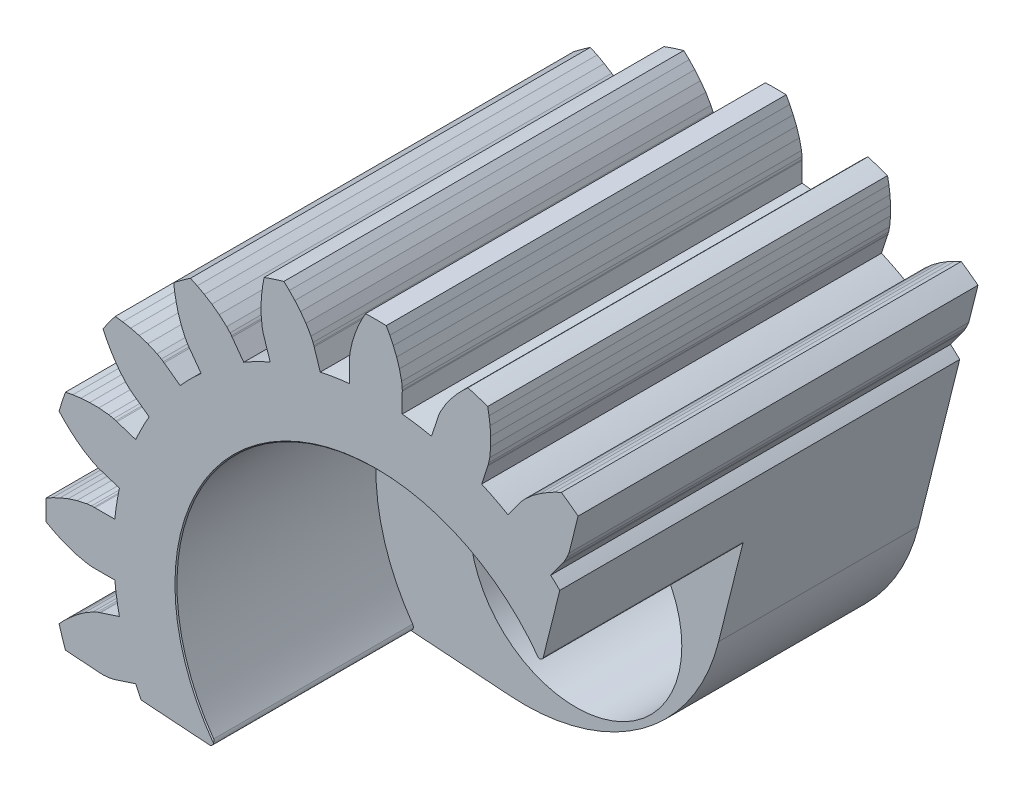
from build123d import *

# Parameters (mm, degrees)
ESQUISSE1_R             = 2.5
BOSS_EXTRU_1_DEPTH      = 10
ENL_V_MAT_EXTRU_1_DEPTH = 16.366359361
CONG_1_R                = 0.1


with BuildPart() as part:
    # Esquisse1 → Boss.-Extru.1 (new body)
    with BuildSketch(Plane.XY.offset(10)):
        with BuildLine():
            Line((7.793958267, 2.165664165), (7.922404173, 2.301741106))
            ThreePointArc((7.922404173, 2.301741106), (7.846216259, 2.549390204), (7.762289089, 2.794524664))
            Line((7.762289089, 2.794524664), (7.578390149, 2.829114613))
            Line((7.578390149, 2.829114613), (7.377914303, 2.855323389))
            Line((7.377914303, 2.855323389), (7.158134809, 2.870961353))
            Line((7.158134809, 2.870961353), (6.928864076, 2.870686786))
            Line((6.928864076, 2.870686786), (6.679108809, 2.846311352))
            Line((6.679108809, 2.846311352), (6.558190124, 2.821898836))
            Line((6.558190124, 2.821898836), (6.500678217, 2.805655377))
            Line((6.500678217, 2.805655377), (6.47616165, 2.797144092))
            Line((6.47616165, 2.797144092), (6.006228129, 2.64416904))
            ThreePointArc((6.006228129, 2.64416904), (5.847230315, 2.979312655), (5.669550006, 3.304937062))
            Line((5.669550006, 3.304937062), (6.069529415, 3.595204787))
            Line((6.069529415, 3.595204787), (6.090825667, 3.610036299))
            Line((6.090825667, 3.610036299), (6.137771551, 3.647016744))
            Line((6.137771551, 3.647016744), (6.228595911, 3.730492697))
            Line((6.228595911, 3.730492697), (6.395118514, 3.918221432))
            Line((6.395118514, 3.918221432), (6.5301026, 4.103543965))
            Line((6.5301026, 4.103543965), (6.646634366, 4.290541076))
            Line((6.646634366, 4.290541076), (6.743267766, 4.468134574))
            Line((6.743267766, 4.468134574), (6.823376995, 4.637243404))
            ThreePointArc((6.823376995, 4.637243404), (6.674390204, 4.849228331), (6.518820007, 5.056430135))
            Line((6.518820007, 5.056430135), (6.333232839, 5.032499234))
            Line((6.333232839, 5.032499234), (6.134470023, 4.995474818))
            Line((6.134470023, 4.995474818), (5.920614906, 4.942431807))
            Line((5.920614906, 4.942431807), (5.702650327, 4.871322125))
            Line((5.702650327, 4.871322125), (5.472651376, 4.770961088))
            Line((5.472651376, 4.770961088), (5.365194756, 4.710377477))
            Line((5.365194756, 4.710377477), (5.315517187, 4.677156873))
            Line((5.315517187, 4.677156873), (5.294830678, 4.661486124))
            Line((5.294830678, 4.661486124), (4.895169231, 4.37078076))
            ThreePointArc((4.895169231, 4.37078076), (4.640388252, 4.640388252), (4.37078076, 4.895169231))
            Line((4.37078076, 4.895169231), (4.661486124, 5.294830678))
            Line((4.661486124, 5.294830678), (4.677156873, 5.315517187))
            Line((4.677156873, 5.315517187), (4.710377477, 5.365194756))
            Line((4.710377477, 5.365194756), (4.770961088, 5.472651376))
            Line((4.770961088, 5.472651376), (4.871322125, 5.702650327))
            Line((4.871322125, 5.702650327), (4.942431807, 5.920614906))
            Line((4.942431807, 5.920614906), (4.995474818, 6.134470023))
            Line((4.995474818, 6.134470023), (5.032499234, 6.333232839))
            Line((5.032499234, 6.333232839), (5.056430135, 6.518820007))
            ThreePointArc((5.056430135, 6.518820007), (4.849228331, 6.674390204), (4.637243404, 6.823376995))
            Line((4.637243404, 6.823376995), (4.468134574, 6.743267766))
            Line((4.468134574, 6.743267766), (4.290541076, 6.646634366))
            Line((4.290541076, 6.646634366), (4.103543965, 6.5301026))
            Line((4.103543965, 6.5301026), (3.918221432, 6.395118514))
            Line((3.918221432, 6.395118514), (3.730492697, 6.228595911))
            Line((3.730492697, 6.228595911), (3.647016744, 6.137771551))
            Line((3.647016744, 6.137771551), (3.610036299, 6.090825667))
            Line((3.610036299, 6.090825667), (3.595204787, 6.069529415))
            Line((3.595204787, 6.069529415), (3.304937062, 5.669550006))
            ThreePointArc((3.304937062, 5.669550006), (2.979312655, 5.847230315), (2.64416904, 6.006228129))
            Line((2.64416904, 6.006228129), (2.797144092, 6.47616165))
            Line((2.797144092, 6.47616165), (2.805655377, 6.500678217))
            Line((2.805655377, 6.500678217), (2.821898836, 6.558190124))
            Line((2.821898836, 6.558190124), (2.846311352, 6.679108809))
            Line((2.846311352, 6.679108809), (2.870686786, 6.928864076))
            Line((2.870686786, 6.928864076), (2.870961353, 7.158134809))
            Line((2.870961353, 7.158134809), (2.855323389, 7.377914303))
            Line((2.855323389, 7.377914303), (2.829114613, 7.578390149))
            Line((2.829114613, 7.578390149), (2.794524664, 7.762289089))
            ThreePointArc((2.794524664, 7.762289089), (2.549390204, 7.846216259), (2.301741106, 7.922404173))
            Line((2.301741106, 7.922404173), (2.165664165, 7.793958267))
            Line((2.165664165, 7.793958267), (2.026624074, 7.647175033))
            Line((2.026624074, 7.647175033), (1.88478955, 7.478561452))
            Line((1.88478955, 7.478561452), (1.750249724, 7.292916145))
            Line((1.750249724, 7.292916145), (1.623167401, 7.076532369))
            Line((1.623167401, 7.076532369), (1.571843322, 6.964357782))
            Line((1.571843322, 6.964357782), (1.551179906, 6.908282007))
            Line((1.551179906, 6.908282007), (1.543655203, 6.883444879))
            Line((1.543655203, 6.883444879), (1.391194627, 6.413344195))
            ThreePointArc((1.391194627, 6.413344195), (1.026601177, 6.481704735), (0.658727632, 6.52935557))
            Line((0.658727632, 6.52935557), (0.658998108, 7.023560798))
            Line((0.658998108, 7.023560798), (0.659516785, 7.049507571))
            Line((0.659516785, 7.049507571), (0.657193076, 7.109224149))
            Line((0.657193076, 7.109224149), (0.643044829, 7.231768534))
            Line((0.643044829, 7.231768534), (0.589048623, 7.476832332))
            Line((0.589048623, 7.476832332), (0.518461199, 7.694966603))
            Line((0.518461199, 7.694966603), (0.435673013, 7.899156926))
            Line((0.435673013, 7.899156926), (0.348796542, 8.081721828))
            Line((0.348796542, 8.081721828), (0.259071648, 8.245931232))
            ThreePointArc((0.259071648, 8.245931232), (0, 8.25), (-0.259071648, 8.245931232))
            Line((-0.259071648, 8.245931232), (-0.348796542, 8.081721828))
            Line((-0.348796542, 8.081721828), (-0.435673013, 7.899156926))
            Line((-0.435673013, 7.899156926), (-0.518461199, 7.694966603))
            Line((-0.518461199, 7.694966603), (-0.589048623, 7.476832332))
            Line((-0.589048623, 7.476832332), (-0.643044829, 7.231768534))
            Line((-0.643044829, 7.231768534), (-0.657193076, 7.109224149))
            Line((-0.657193076, 7.109224149), (-0.659516785, 7.049507571))
            Line((-0.659516785, 7.049507571), (-0.658998108, 7.023560798))
            Line((-0.658998108, 7.023560798), (-0.658727632, 6.52935557))
            ThreePointArc((-0.658727632, 6.52935557), (-1.026601177, 6.481704735), (-1.391194627, 6.413344195))
            Line((-1.391194627, 6.413344195), (-1.543655203, 6.883444879))
            Line((-1.543655203, 6.883444879), (-1.551179906, 6.908282007))
            Line((-1.551179906, 6.908282007), (-1.571843322, 6.964357782))
            Line((-1.571843322, 6.964357782), (-1.623167401, 7.076532369))
            Line((-1.623167401, 7.076532369), (-1.750249724, 7.292916145))
            Line((-1.750249724, 7.292916145), (-1.88478955, 7.478561452))
            Line((-1.88478955, 7.478561452), (-2.026624074, 7.647175033))
            Line((-2.026624074, 7.647175033), (-2.165664165, 7.793958267))
            Line((-2.165664165, 7.793958267), (-2.301741106, 7.922404173))
            ThreePointArc((-2.301741106, 7.922404173), (-2.549390204, 7.846216259), (-2.794524664, 7.762289089))
            Line((-2.794524664, 7.762289089), (-2.829114613, 7.578390149))
            Line((-2.829114613, 7.578390149), (-2.855323389, 7.377914303))
            Line((-2.855323389, 7.377914303), (-2.870961353, 7.158134809))
            Line((-2.870961353, 7.158134809), (-2.870686786, 6.928864076))
            Line((-2.870686786, 6.928864076), (-2.846311352, 6.679108809))
            Line((-2.846311352, 6.679108809), (-2.821898836, 6.558190124))
            Line((-2.821898836, 6.558190124), (-2.805655377, 6.500678217))
            Line((-2.805655377, 6.500678217), (-2.797144092, 6.47616165))
            Line((-2.797144092, 6.47616165), (-2.64416904, 6.006228129))
            ThreePointArc((-2.64416904, 6.006228129), (-2.979312655, 5.847230315), (-3.304937062, 5.669550006))
            Line((-3.304937062, 5.669550006), (-3.595204787, 6.069529415))
            Line((-3.595204787, 6.069529415), (-3.610036299, 6.090825667))
            Line((-3.610036299, 6.090825667), (-3.647016744, 6.137771551))
            Line((-3.647016744, 6.137771551), (-3.730492697, 6.228595911))
            Line((-3.730492697, 6.228595911), (-3.918221432, 6.395118514))
            Line((-3.918221432, 6.395118514), (-4.103543965, 6.5301026))
            Line((-4.103543965, 6.5301026), (-4.290541076, 6.646634366))
            Line((-4.290541076, 6.646634366), (-4.468134574, 6.743267766))
            Line((-4.468134574, 6.743267766), (-4.637243404, 6.823376995))
            ThreePointArc((-4.637243404, 6.823376995), (-4.849228331, 6.674390204), (-5.056430135, 6.518820007))
            Line((-5.056430135, 6.518820007), (-5.032499234, 6.333232839))
            Line((-5.032499234, 6.333232839), (-4.995474818, 6.134470023))
            Line((-4.995474818, 6.134470023), (-4.942431807, 5.920614906))
            Line((-4.942431807, 5.920614906), (-4.871322125, 5.702650327))
            Line((-4.871322125, 5.702650327), (-4.770961088, 5.472651376))
            Line((-4.770961088, 5.472651376), (-4.710377477, 5.365194756))
            Line((-4.710377477, 5.365194756), (-4.677156873, 5.315517187))
            Line((-4.677156873, 5.315517187), (-4.661486124, 5.294830678))
            Line((-4.661486124, 5.294830678), (-4.37078076, 4.895169231))
            ThreePointArc((-4.37078076, 4.895169231), (-4.640388252, 4.640388252), (-4.895169231, 4.37078076))
            Line((-4.895169231, 4.37078076), (-5.294830678, 4.661486124))
            Line((-5.294830678, 4.661486124), (-5.315517187, 4.677156873))
            Line((-5.315517187, 4.677156873), (-5.365194756, 4.710377477))
            Line((-5.365194756, 4.710377477), (-5.472651376, 4.770961088))
            Line((-5.472651376, 4.770961088), (-5.702650327, 4.871322125))
            Line((-5.702650327, 4.871322125), (-5.920614906, 4.942431807))
            Line((-5.920614906, 4.942431807), (-6.134470023, 4.995474818))
            Line((-6.134470023, 4.995474818), (-6.333232839, 5.032499234))
            Line((-6.333232839, 5.032499234), (-6.518820007, 5.056430135))
            ThreePointArc((-6.518820007, 5.056430135), (-6.674390204, 4.849228331), (-6.823376995, 4.637243404))
            Line((-6.823376995, 4.637243404), (-6.743267766, 4.468134574))
            Line((-6.743267766, 4.468134574), (-6.646634366, 4.290541076))
            Line((-6.646634366, 4.290541076), (-6.5301026, 4.103543965))
            Line((-6.5301026, 4.103543965), (-6.395118514, 3.918221432))
            Line((-6.395118514, 3.918221432), (-6.228595911, 3.730492697))
            Line((-6.228595911, 3.730492697), (-6.137771551, 3.647016744))
            Line((-6.137771551, 3.647016744), (-6.090825667, 3.610036299))
            Line((-6.090825667, 3.610036299), (-6.069529415, 3.595204787))
            Line((-6.069529415, 3.595204787), (-5.669550006, 3.304937062))
            ThreePointArc((-5.669550006, 3.304937062), (-5.847230315, 2.979312655), (-6.006228129, 2.64416904))
            Line((-6.006228129, 2.64416904), (-6.47616165, 2.797144092))
            Line((-6.47616165, 2.797144092), (-6.500678217, 2.805655377))
            Line((-6.500678217, 2.805655377), (-6.558190124, 2.821898836))
            Line((-6.558190124, 2.821898836), (-6.679108809, 2.846311352))
            Line((-6.679108809, 2.846311352), (-6.928864076, 2.870686786))
            Line((-6.928864076, 2.870686786), (-7.158134809, 2.870961353))
            Line((-7.158134809, 2.870961353), (-7.377914303, 2.855323389))
            Line((-7.377914303, 2.855323389), (-7.578390149, 2.829114613))
            Line((-7.578390149, 2.829114613), (-7.762289089, 2.794524664))
            ThreePointArc((-7.762289089, 2.794524664), (-7.846216259, 2.549390204), (-7.922404173, 2.301741106))
            Line((-7.922404173, 2.301741106), (-7.793958267, 2.165664165))
            Line((-7.793958267, 2.165664165), (-7.647175033, 2.026624074))
            Line((-7.647175033, 2.026624074), (-7.478561452, 1.88478955))
            Line((-7.478561452, 1.88478955), (-7.292916145, 1.750249724))
            Line((-7.292916145, 1.750249724), (-7.076532369, 1.623167401))
            Line((-7.076532369, 1.623167401), (-6.964357782, 1.571843322))
            Line((-6.964357782, 1.571843322), (-6.908282007, 1.551179906))
            Line((-6.908282007, 1.551179906), (-6.883444879, 1.543655203))
            Line((-6.883444879, 1.543655203), (-6.413344195, 1.391194627))
            ThreePointArc((-6.413344195, 1.391194627), (-6.481704735, 1.026601177), (-6.52935557, 0.658727632))
            Line((-6.52935557, 0.658727632), (-7.023560798, 0.658998108))
            Line((-7.023560798, 0.658998108), (-7.049507571, 0.659516785))
            Line((-7.049507571, 0.659516785), (-7.109224149, 0.657193076))
            Line((-7.109224149, 0.657193076), (-7.231768534, 0.643044829))
            Line((-7.231768534, 0.643044829), (-7.476832332, 0.589048623))
            Line((-7.476832332, 0.589048623), (-7.694966603, 0.518461199))
            Line((-7.694966603, 0.518461199), (-7.899156926, 0.435673013))
            Line((-7.899156926, 0.435673013), (-8.081721828, 0.348796542))
            Line((-8.081721828, 0.348796542), (-8.245931232, 0.259071648))
            ThreePointArc((-8.245931232, 0.259071648), (-8.25, 0), (-8.245931232, -0.259071648))
            Line((-8.245931232, -0.259071648), (-8.081721828, -0.348796542))
            Line((-8.081721828, -0.348796542), (-7.899156926, -0.435673013))
            Line((-7.899156926, -0.435673013), (-7.694966603, -0.518461199))
            Line((-7.694966603, -0.518461199), (-7.476832332, -0.589048623))
            Line((-7.476832332, -0.589048623), (-7.231768534, -0.643044829))
            Line((-7.231768534, -0.643044829), (-7.109224149, -0.657193076))
            Line((-7.109224149, -0.657193076), (-7.049507571, -0.659516785))
            Line((-7.049507571, -0.659516785), (-7.023560798, -0.658998108))
            Line((-7.023560798, -0.658998108), (-6.52935557, -0.658727632))
            ThreePointArc((-6.52935557, -0.658727632), (-6.481704735, -1.026601177), (-6.413344195, -1.391194627))
            Line((-6.413344195, -1.391194627), (-6.883444879, -1.543655203))
            Line((-6.883444879, -1.543655203), (-6.908282007, -1.551179906))
            Line((-6.908282007, -1.551179906), (-6.964357782, -1.571843322))
            Line((-6.964357782, -1.571843322), (-7.076532369, -1.623167401))
            Line((-7.076532369, -1.623167401), (-7.292916145, -1.750249724))
            Line((-7.292916145, -1.750249724), (-7.478561452, -1.88478955))
            Line((-7.478561452, -1.88478955), (-7.647175033, -2.026624074))
            Line((-7.647175033, -2.026624074), (-7.793958267, -2.165664165))
            Line((-7.793958267, -2.165664165), (-7.922404173, -2.301741106))
            ThreePointArc((-7.922404173, -2.301741106), (-7.846216259, -2.549390204), (-7.762289089, -2.794524664))
            Line((-7.762289089, -2.794524664), (-7.578390149, -2.829114613))
            Line((-7.578390149, -2.829114613), (-7.377914303, -2.855323389))
            Line((-7.377914303, -2.855323389), (-7.158134809, -2.870961353))
            Line((-7.158134809, -2.870961353), (-6.928864076, -2.870686786))
            Line((-6.928864076, -2.870686786), (-6.679108809, -2.846311352))
            Line((-6.679108809, -2.846311352), (-6.558190124, -2.821898836))
            Line((-6.558190124, -2.821898836), (-6.500678217, -2.805655377))
            Line((-6.500678217, -2.805655377), (-6.47616165, -2.797144092))
            Line((-6.47616165, -2.797144092), (-6.006228129, -2.64416904))
            ThreePointArc((-6.006228129, -2.64416904), (-5.847230315, -2.979312655), (-5.669550006, -3.304937062))
            Line((-5.669550006, -3.304937062), (-6.069529415, -3.595204787))
            Line((-6.069529415, -3.595204787), (-6.090825667, -3.610036299))
            Line((-6.090825667, -3.610036299), (-6.137771551, -3.647016744))
            Line((-6.137771551, -3.647016744), (-6.228595911, -3.730492697))
            Line((-6.228595911, -3.730492697), (-6.395118514, -3.918221432))
            Line((-6.395118514, -3.918221432), (-6.5301026, -4.103543965))
            Line((-6.5301026, -4.103543965), (-6.646634366, -4.290541076))
            Line((-6.646634366, -4.290541076), (-6.743267766, -4.468134574))
            Line((-6.743267766, -4.468134574), (-6.823376995, -4.637243404))
            ThreePointArc((-6.823376995, -4.637243404), (-6.674390204, -4.849228331), (-6.518820007, -5.056430135))
            Line((-6.518820007, -5.056430135), (-6.333232839, -5.032499234))
            Line((-6.333232839, -5.032499234), (-6.134470023, -4.995474818))
            Line((-6.134470023, -4.995474818), (-5.920614906, -4.942431807))
            Line((-5.920614906, -4.942431807), (-5.702650327, -4.871322125))
            Line((-5.702650327, -4.871322125), (-5.472651376, -4.770961088))
            Line((-5.472651376, -4.770961088), (-5.365194756, -4.710377477))
            Line((-5.365194756, -4.710377477), (-5.315517187, -4.677156873))
            Line((-5.315517187, -4.677156873), (-5.294830678, -4.661486124))
            Line((-5.294830678, -4.661486124), (-4.895169231, -4.37078076))
            ThreePointArc((-4.895169231, -4.37078076), (-4.640388252, -4.640388252), (-4.37078076, -4.895169231))
            Line((-4.37078076, -4.895169231), (-4.661486124, -5.294830678))
            Line((-4.661486124, -5.294830678), (-4.677156873, -5.315517187))
            Line((-4.677156873, -5.315517187), (-4.710377477, -5.365194756))
            Line((-4.710377477, -5.365194756), (-4.770961088, -5.472651376))
            Line((-4.770961088, -5.472651376), (-4.871322125, -5.702650327))
            Line((-4.871322125, -5.702650327), (-4.942431807, -5.920614906))
            Line((-4.942431807, -5.920614906), (-4.995474818, -6.134470023))
            Line((-4.995474818, -6.134470023), (-5.032499234, -6.333232839))
            Line((-5.032499234, -6.333232839), (-5.056430135, -6.518820007))
            ThreePointArc((-5.056430135, -6.518820007), (-4.849228331, -6.674390204), (-4.637243404, -6.823376995))
            Line((-4.637243404, -6.823376995), (-4.468134574, -6.743267766))
            Line((-4.468134574, -6.743267766), (-4.290541076, -6.646634366))
            Line((-4.290541076, -6.646634366), (-4.103543965, -6.5301026))
            Line((-4.103543965, -6.5301026), (-3.918221432, -6.395118514))
            Line((-3.918221432, -6.395118514), (-3.730492697, -6.228595911))
            Line((-3.730492697, -6.228595911), (-3.647016744, -6.137771551))
            Line((-3.647016744, -6.137771551), (-3.610036299, -6.090825667))
            Line((-3.610036299, -6.090825667), (-3.595204787, -6.069529415))
            Line((-3.595204787, -6.069529415), (-3.304937062, -5.669550006))
            ThreePointArc((-3.304937062, -5.669550006), (-2.979312655, -5.847230315), (-2.64416904, -6.006228129))
            Line((-2.64416904, -6.006228129), (-2.797144092, -6.47616165))
            Line((-2.797144092, -6.47616165), (-2.805655377, -6.500678217))
            Line((-2.805655377, -6.500678217), (-2.821898836, -6.558190124))
            Line((-2.821898836, -6.558190124), (-2.846311352, -6.679108809))
            Line((-2.846311352, -6.679108809), (-2.870686786, -6.928864076))
            Line((-2.870686786, -6.928864076), (-2.870961353, -7.158134809))
            Line((-2.870961353, -7.158134809), (-2.855323389, -7.377914303))
            Line((-2.855323389, -7.377914303), (-2.829114613, -7.578390149))
            Line((-2.829114613, -7.578390149), (-2.794524664, -7.762289089))
            ThreePointArc((-2.794524664, -7.762289089), (-2.549390204, -7.846216259), (-2.301741106, -7.922404173))
            Line((-2.301741106, -7.922404173), (-2.165664165, -7.793958267))
            Line((-2.165664165, -7.793958267), (-2.026624074, -7.647175033))
            Line((-2.026624074, -7.647175033), (-1.88478955, -7.478561452))
            Line((-1.88478955, -7.478561452), (-1.750249724, -7.292916145))
            Line((-1.750249724, -7.292916145), (-1.623167401, -7.076532369))
            Line((-1.623167401, -7.076532369), (-1.571843322, -6.964357782))
            Line((-1.571843322, -6.964357782), (-1.551179906, -6.908282007))
            Line((-1.551179906, -6.908282007), (-1.543655203, -6.883444879))
            Line((-1.543655203, -6.883444879), (-1.391194627, -6.413344195))
            ThreePointArc((-1.391194627, -6.413344195), (-1.026601177, -6.481704735), (-0.658727632, -6.52935557))
            Line((-0.658727632, -6.52935557), (-0.658998108, -7.023560798))
            Line((-0.658998108, -7.023560798), (-0.659516785, -7.049507571))
            Line((-0.659516785, -7.049507571), (-0.657193076, -7.109224149))
            Line((-0.657193076, -7.109224149), (-0.643044829, -7.231768534))
            Line((-0.643044829, -7.231768534), (-0.589048623, -7.476832332))
            Line((-0.589048623, -7.476832332), (-0.518461199, -7.694966603))
            Line((-0.518461199, -7.694966603), (-0.435673013, -7.899156926))
            Line((-0.435673013, -7.899156926), (-0.348796542, -8.081721828))
            Line((-0.348796542, -8.081721828), (-0.259071648, -8.245931232))
            ThreePointArc((-0.259071648, -8.245931232), (0, -8.25), (0.259071648, -8.245931232))
            Line((0.259071648, -8.245931232), (0.348796542, -8.081721828))
            Line((0.348796542, -8.081721828), (0.435673013, -7.899156926))
            Line((0.435673013, -7.899156926), (0.518461199, -7.694966603))
            Line((0.518461199, -7.694966603), (0.589048623, -7.476832332))
            Line((0.589048623, -7.476832332), (0.643044829, -7.231768534))
            Line((0.643044829, -7.231768534), (0.657193076, -7.109224149))
            Line((0.657193076, -7.109224149), (0.659516785, -7.049507571))
            Line((0.659516785, -7.049507571), (0.658998108, -7.023560798))
            Line((0.658998108, -7.023560798), (0.658727632, -6.52935557))
            ThreePointArc((0.658727632, -6.52935557), (1.026601177, -6.481704735), (1.391194627, -6.413344195))
            Line((1.391194627, -6.413344195), (1.543655203, -6.883444879))
            Line((1.543655203, -6.883444879), (1.551179906, -6.908282007))
            Line((1.551179906, -6.908282007), (1.571843322, -6.964357782))
            Line((1.571843322, -6.964357782), (1.623167401, -7.076532369))
            Line((1.623167401, -7.076532369), (1.750249724, -7.292916145))
            Line((1.750249724, -7.292916145), (1.88478955, -7.478561452))
            Line((1.88478955, -7.478561452), (2.026624074, -7.647175033))
            Line((2.026624074, -7.647175033), (2.165664165, -7.793958267))
            Line((2.165664165, -7.793958267), (2.301741106, -7.922404173))
            ThreePointArc((2.301741106, -7.922404173), (2.549390204, -7.846216259), (2.794524664, -7.762289089))
            Line((2.794524664, -7.762289089), (2.829114613, -7.578390149))
            Line((2.829114613, -7.578390149), (2.855323389, -7.377914303))
            Line((2.855323389, -7.377914303), (2.870961353, -7.158134809))
            Line((2.870961353, -7.158134809), (2.870686786, -6.928864076))
            Line((2.870686786, -6.928864076), (2.846311352, -6.679108809))
            Line((2.846311352, -6.679108809), (2.821898836, -6.558190124))
            Line((2.821898836, -6.558190124), (2.805655377, -6.500678217))
            Line((2.805655377, -6.500678217), (2.797144092, -6.47616165))
            Line((2.797144092, -6.47616165), (2.64416904, -6.006228129))
            ThreePointArc((2.64416904, -6.006228129), (2.979312655, -5.847230315), (3.304937062, -5.669550006))
            Line((3.304937062, -5.669550006), (3.595204787, -6.069529415))
            Line((3.595204787, -6.069529415), (3.610036299, -6.090825667))
            Line((3.610036299, -6.090825667), (3.647016744, -6.137771551))
            Line((3.647016744, -6.137771551), (3.730492697, -6.228595911))
            Line((3.730492697, -6.228595911), (3.918221432, -6.395118514))
            Line((3.918221432, -6.395118514), (4.103543965, -6.5301026))
            Line((4.103543965, -6.5301026), (4.290541076, -6.646634366))
            Line((4.290541076, -6.646634366), (4.468134574, -6.743267766))
            Line((4.468134574, -6.743267766), (4.637243404, -6.823376995))
            ThreePointArc((4.637243404, -6.823376995), (4.849228331, -6.674390204), (5.056430135, -6.518820007))
            Line((5.056430135, -6.518820007), (5.032499234, -6.333232839))
            Line((5.032499234, -6.333232839), (4.995474818, -6.134470023))
            Line((4.995474818, -6.134470023), (4.942431807, -5.920614906))
            Line((4.942431807, -5.920614906), (4.871322125, -5.702650327))
            Line((4.871322125, -5.702650327), (4.770961088, -5.472651376))
            Line((4.770961088, -5.472651376), (4.710377477, -5.365194756))
            Line((4.710377477, -5.365194756), (4.677156873, -5.315517187))
            Line((4.677156873, -5.315517187), (4.661486124, -5.294830678))
            Line((4.661486124, -5.294830678), (4.37078076, -4.895169231))
            ThreePointArc((4.37078076, -4.895169231), (4.640388252, -4.640388252), (4.895169231, -4.37078076))
            Line((4.895169231, -4.37078076), (5.294830678, -4.661486124))
            Line((5.294830678, -4.661486124), (5.315517187, -4.677156873))
            Line((5.315517187, -4.677156873), (5.365194756, -4.710377477))
            Line((5.365194756, -4.710377477), (5.472651376, -4.770961088))
            Line((5.472651376, -4.770961088), (5.702650327, -4.871322125))
            Line((5.702650327, -4.871322125), (5.920614906, -4.942431807))
            Line((5.920614906, -4.942431807), (6.134470023, -4.995474818))
            Line((6.134470023, -4.995474818), (6.333232839, -5.032499234))
            Line((6.333232839, -5.032499234), (6.518820007, -5.056430135))
            ThreePointArc((6.518820007, -5.056430135), (6.674390204, -4.849228331), (6.823376995, -4.637243404))
            Line((6.823376995, -4.637243404), (6.743267766, -4.468134574))
            Line((6.743267766, -4.468134574), (6.646634366, -4.290541076))
            Line((6.646634366, -4.290541076), (6.5301026, -4.103543965))
            Line((6.5301026, -4.103543965), (6.395118514, -3.918221432))
            Line((6.395118514, -3.918221432), (6.228595911, -3.730492697))
            Line((6.228595911, -3.730492697), (6.137771551, -3.647016744))
            Line((6.137771551, -3.647016744), (6.090825667, -3.610036299))
            Line((6.090825667, -3.610036299), (6.069529415, -3.595204787))
            Line((6.069529415, -3.595204787), (5.669550006, -3.304937062))
            ThreePointArc((5.669550006, -3.304937062), (5.847230315, -2.979312655), (6.006228129, -2.64416904))
            Line((6.006228129, -2.64416904), (6.47616165, -2.797144092))
            Line((6.47616165, -2.797144092), (6.500678217, -2.805655377))
            Line((6.500678217, -2.805655377), (6.558190124, -2.821898836))
            Line((6.558190124, -2.821898836), (6.679108809, -2.846311352))
            Line((6.679108809, -2.846311352), (6.928864076, -2.870686786))
            Line((6.928864076, -2.870686786), (7.158134809, -2.870961353))
            Line((7.158134809, -2.870961353), (7.377914303, -2.855323389))
            Line((7.377914303, -2.855323389), (7.578390149, -2.829114613))
            Line((7.578390149, -2.829114613), (7.762289089, -2.794524664))
            ThreePointArc((7.762289089, -2.794524664), (7.846216259, -2.549390204), (7.922404173, -2.301741106))
            Line((7.922404173, -2.301741106), (7.793958267, -2.165664165))
            Line((7.793958267, -2.165664165), (7.647175033, -2.026624074))
            Line((7.647175033, -2.026624074), (7.478561452, -1.88478955))
            Line((7.478561452, -1.88478955), (7.292916145, -1.750249724))
            Line((7.292916145, -1.750249724), (7.076532369, -1.623167401))
            Line((7.076532369, -1.623167401), (6.964357782, -1.571843322))
            Line((6.964357782, -1.571843322), (6.908282007, -1.551179906))
            Line((6.908282007, -1.551179906), (6.883444879, -1.543655203))
            Line((6.883444879, -1.543655203), (6.413344195, -1.391194627))
            ThreePointArc((6.413344195, -1.391194627), (6.481704735, -1.026601177), (6.52935557, -0.658727632))
            Line((6.52935557, -0.658727632), (7.023560798, -0.658998108))
            Line((7.023560798, -0.658998108), (7.049507571, -0.659516785))
            Line((7.049507571, -0.659516785), (7.109224149, -0.657193076))
            Line((7.109224149, -0.657193076), (7.231768534, -0.643044829))
            Line((7.231768534, -0.643044829), (7.476832332, -0.589048623))
            Line((7.476832332, -0.589048623), (7.694966603, -0.518461199))
            Line((7.694966603, -0.518461199), (7.899156926, -0.435673013))
            Line((7.899156926, -0.435673013), (8.081721828, -0.348796542))
            Line((8.081721828, -0.348796542), (8.245931232, -0.259071648))
            ThreePointArc((8.245931232, -0.259071648), (8.25, 0), (8.245931232, 0.259071648))
            Line((8.245931232, 0.259071648), (8.081721828, 0.348796542))
            Line((8.081721828, 0.348796542), (7.899156926, 0.435673013))
            Line((7.899156926, 0.435673013), (7.694966603, 0.518461199))
            Line((7.694966603, 0.518461199), (7.476832332, 0.589048623))
            Line((7.476832332, 0.589048623), (7.231768534, 0.643044829))
            Line((7.231768534, 0.643044829), (7.109224149, 0.657193076))
            Line((7.109224149, 0.657193076), (7.049507571, 0.659516785))
            Line((7.049507571, 0.659516785), (7.023560798, 0.658998108))
            Line((7.023560798, 0.658998108), (6.52935557, 0.658727632))
            ThreePointArc((6.52935557, 0.658727632), (6.481704735, 1.026601177), (6.413344195, 1.391194627))
            Line((6.413344195, 1.391194627), (6.883444879, 1.543655203))
            Line((6.883444879, 1.543655203), (6.908282007, 1.551179906))
            Line((6.908282007, 1.551179906), (6.964357782, 1.571843322))
            Line((6.964357782, 1.571843322), (7.076532369, 1.623167401))
            Line((7.076532369, 1.623167401), (7.292916145, 1.750249724))
            Line((7.292916145, 1.750249724), (7.478561452, 1.88478955))
            Line((7.478561452, 1.88478955), (7.647175033, 2.026624074))
            Line((7.647175033, 2.026624074), (7.793958267, 2.165664165))
        make_face()
        with Locations(Location((0, 0, 0), (0, 0, 180))):
            Circle(ESQUISSE1_R, mode=Mode.SUBTRACT)
    extrude(amount=-BOSS_EXTRU_1_DEPTH)

    # Esquisse2 → Chambrage pour vis à tête cylindrique à 6 pans creux (ou vis CHC) M51 (revolve, cut)
    with BuildSketch(Plane(origin=(0, 0, 10), x_dir=(0, -1, 0), z_dir=(1, 0, 0))):
        Polygon((0, 0), (0, 10), (2.65, 10), (2.65, 5), (5, 5), (5, 0.025), (5.025, 0), align=None)
    revolve(axis=Axis((0, 0, 16.35), (0, 0, -1)), mode=Mode.SUBTRACT)

    # Esquisse4 → Enlèv. mat.-Extru.1 (cut, through all)
    with BuildSketch(Plane.XY.offset(10)):
        with BuildLine():
            Line((5.056430135, 6.518820007), (3.569465429, 0.554930315))
            ThreePointArc((3.569465429, 0.554930315), (1.656913059, -2.280545179), (-1.630795571, -3.223280458))
            Line((-1.630795571, -3.223280458), (-7.762289089, -2.794524664))
            ThreePointArc((-7.762289089, -2.794524664), (4.849228331, -6.674390204), (5.056430135, 6.518820007))
        make_face()
    extrude(amount=-ENL_V_MAT_EXTRU_1_DEPTH, mode=Mode.SUBTRACT)

    # Congé1
    cong_1_edges = [part.edges().sort_by_distance(p)[0] for p in [
        (4.132781972, 2.814269563, 7.4875),
        (-3.95362927, -3.060852103, 7.4875),
    ]]
    fillet(cong_1_edges, radius=CONG_1_R)


solid = part.part
